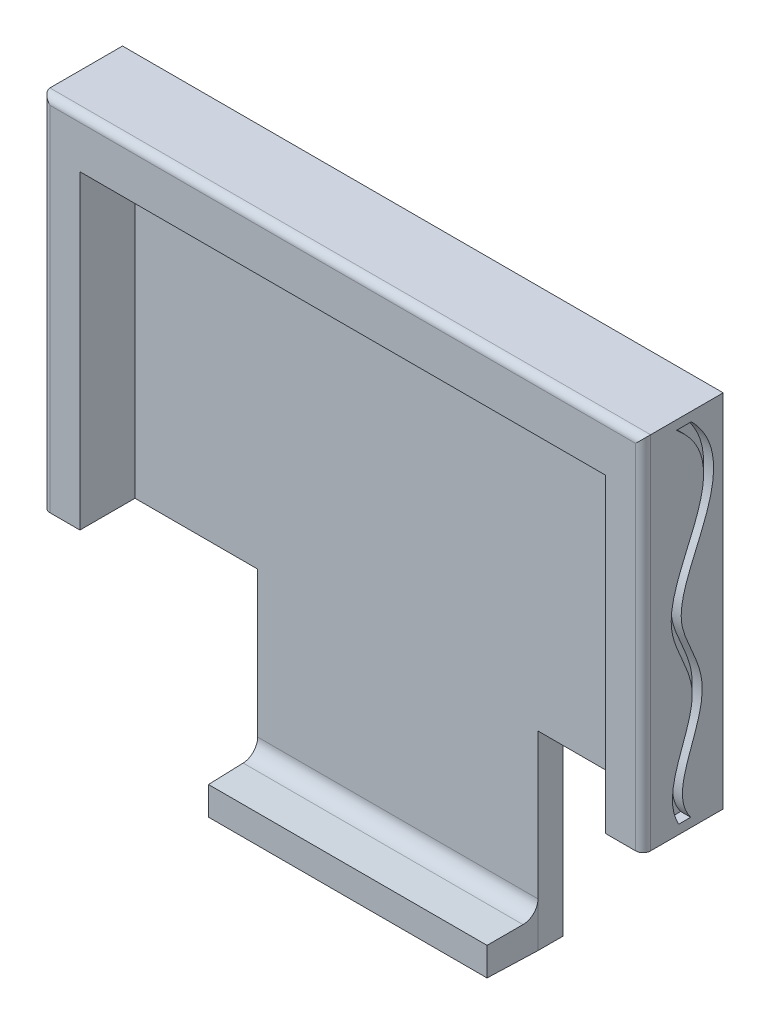
from build123d import *

# Parameters (mm, degrees)
ESBO_O1_W                  = 120
ESBO_O1_H                  = 110
RESSALTO_EXTRUS_O1_DEPTH   = 16
ESBO_O2_W                  = 105
ESBO_O2_H                  = 100
CORTE_EXTRUS_O1_DEPTH      = 11
CORTE_EXTRUS_O2_DEPTH      = 164.159431232
CORTE_EXTRUS_O2_DEPTH_BACK = 164.159431232
ESBO_O3_W                  = 32
ESBO_O3_H                  = 38
ESBO_O4_W                  = 56
ESBO_O4_H                  = 6
RESSALTO_EXTRUS_O2_DEPTH   = 10
RESSALTO_EXTRUS_O2_TAPER   = 1
CORTE_EXTRUS_O3_START      = -7.5
CORTE_EXTRUS_O3_DEPTH      = 105
CORTE_EXTRUS_O5_START      = -2
CORTE_EXTRUS_O5_DEPTH      = 166.572613845
ESBO_O9_W                  = 3.98970614
ESBO_O9_H                  = 1.819278396
RESSALTO_EXTRUS_O3_DEPTH   = 16
ESBO_O11_W                 = 5.503817982
ESBO_O11_H                 = 82
RESSALTO_EXTRUS_O4_DEPTH   = 16
RESSALTO_EXTRUS_O7_DEPTH   = 107
RESSALTO_EXTRUS_O8_REACH   = 165.573
ESBO_O16_W                 = 3.99
ESBO_O16_H                 = 1.82
ESBO_O17_W                 = 5.503817982
ESBO_O17_H                 = 10
CORTE_EXTRUS_O6_DEPTH      = 164.572613995
FILETE2_R                  = 1.5
CORTE_EXTRUS_O7_DEPTH      = 2
FILETE3_R                  = 3


with BuildPart() as part:
    # Esboço1 → Ressalto-extrusão1 (new body)
    with BuildSketch(Plane.XY):
        with Locations((60, 55)):
            Rectangle(ESBO_O1_W, ESBO_O1_H)
    extrude(amount=RESSALTO_EXTRUS_O1_DEPTH)

    # Esboço2 → Corte-extrusão1 (cut)
    with BuildSketch(Plane.XY.offset(16)):
        with Locations((60, 50)):
            Rectangle(ESBO_O2_W, ESBO_O2_H)
    extrude(amount=-CORTE_EXTRUS_O1_DEPTH, mode=Mode.SUBTRACT)

    # Esboço3 → Corte-extrusão2 (cut, two sides: drawn at the far end of the back side and taken through both)
    with BuildSketch(Plane.XY.offset(5).offset(-CORTE_EXTRUS_O2_DEPTH_BACK)):
        with Locations((16, 19)):
            Rectangle(ESBO_O3_W, ESBO_O3_H)
        with Locations((104, 19)):
            Rectangle(ESBO_O3_W, ESBO_O3_H)
    extrude(amount=CORTE_EXTRUS_O2_DEPTH + CORTE_EXTRUS_O2_DEPTH_BACK, mode=Mode.SUBTRACT)

    # Esboço4 → Ressalto-extrusão2 (add)
    with BuildSketch(Plane.XY.offset(5)):
        with Locations((60, 3)):
            Rectangle(ESBO_O4_W, ESBO_O4_H)
    extrude(amount=RESSALTO_EXTRUS_O2_DEPTH, taper=RESSALTO_EXTRUS_O2_TAPER)

    # Esboço6 → Corte-extrusão3 (cut)
    with BuildSketch(Plane.ZY.offset(CORTE_EXTRUS_O3_START)):
        Polygon((13.186092373, 100), (2.204933851, 107.160275857), (2.204933851, 101.956517901), (5.032172426, 96.343015224), align=None)
    extrude(amount=-CORTE_EXTRUS_O3_DEPTH, mode=Mode.SUBTRACT)

    # Esboço8 → Corte-extrusão5 (cut)
    with BuildSketch(Plane(origin=(120, 0, 0), x_dir=(0, 0, -1), z_dir=(1, 0, 0)).offset(CORTE_EXTRUS_O5_START)):
        with BuildLine():
            Line((-11.792318261, 110), (-10.690143183, 111.668894873))
            add(Edge.make_bspline(
                [(-6.082458572, 39.276495845), (-6.214162579, 39.435352315), (-6.474263337, 39.767158501), (-6.915598907, 40.402945876), (-7.360031734, 41.185353069), (-7.738204238, 42.100680466), (-8.069368292, 43.31178852), (-8.201478516, 44.846869769), (-7.984741062, 46.805669125), (-7.456321103, 48.885471276), (-6.465738379, 51.791803071), (-5.272267128, 54.856926621), (-4.41789659, 58.109560913), (-4.09927868, 60.665032964), (-4.356032099, 63.353506331), (-5.107827309, 65.798820309), (-6.060511408, 68.085684526), (-7.031478084, 70.239150077), (-7.843018941, 72.276734787), (-8.337743386, 74.135986953), (-8.438637878, 75.927638214), (-8.142119764, 78.508684731), (-7.037426342, 81.996601684), (-5.057308292, 86.490856249), (-3.068625359, 91.213924398), (-1.976015748, 95.384766301), (-1.867130555, 98.890807063), (-2.294947679, 101.57514134), (-3.333053367, 104.2468859), (-4.750190463, 106.40275737), (-6.230261913, 108.071676743), (-7.517771082, 109.295924067), (-8.746974053, 110.296643718), (-9.821340585, 111.082325969), (-10.401129021, 111.478023529), (-10.690143183, 111.668894873)],
                knots=[0, 0, 0, 0, 0.0078125, 0.015625, 0.03125, 0.046875, 0.0625, 0.09375, 0.125, 0.15625, 0.1875, 0.25, 0.28125, 0.3125, 0.34375, 0.375, 0.40625, 0.4375, 0.46875, 0.5, 0.53125, 0.5625, 0.625, 0.6875, 0.75, 0.8125, 0.84375, 0.875, 0.90625, 0.9375, 0.953125, 0.96875, 0.984375, 0.9921875, 1, 1, 1, 1], degree=3))
            Line((-6.082458572, 39.276495845), (-4.14961014, 38))
            Line((-4.14961014, 38), (-7.622120339, 38))
            add(Edge.make_bspline(
                [(-7.622120339, 38), (-14.29051588, 46.043170452), (-0.893468518, 58.395190772), (-18.324006057, 81.192013192), (5.928787095, 98.29659016), (-11.792318261, 110)],
                knots=[0, 0, 0, 0, 0.328017048, 0.501208499, 1, 1, 1, 1], degree=3))
        make_face()
    corte_extrus_o5 = extrude(amount=CORTE_EXTRUS_O5_DEPTH, mode=Mode.SUBTRACT)

    # Esboço9 → Ressalto-extrusão3 (add)
    with BuildSketch(Plane.XY.offset(16)):
        with Locations((1.99485307, 109.090360802)):
            Rectangle(ESBO_O9_W, ESBO_O9_H)
        with Locations((118.00514693, 109.090360802)):
            Rectangle(ESBO_O9_W, ESBO_O9_H)
        with Locations((1.99485307, 38.909639198)):
            Rectangle(ESBO_O9_W, ESBO_O9_H)
        with Locations((118.00514693, 38.909639198)):
            Rectangle(ESBO_O9_W, ESBO_O9_H)
    extrude(amount=-RESSALTO_EXTRUS_O3_DEPTH)

    # Esboço11 → Ressalto-extrusão4 (add)
    with BuildSketch(Plane.XY.offset(16)):
        with Locations((4.748091009, 69)):
            Rectangle(ESBO_O11_W, ESBO_O11_H)
        with Locations((115.251908991, 69)):
            Rectangle(ESBO_O11_W, ESBO_O11_H)
    extrude(amount=-RESSALTO_EXTRUS_O4_DEPTH)

    # Esboço15 → Ressalto-extrusão7 (add)
    with BuildSketch(Plane.ZY.offset(-112.5)):
        Polygon((5.982938485, 104.696823999), (8.582940457, 103.001490004), (11.792318261, 110), (8.41615138, 110), (2.795224019, 106.775376538), align=None)
    extrude(amount=RESSALTO_EXTRUS_O7_DEPTH)

    # Espelhar1: Corte-extrusão5 across plane
    add(corte_extrus_o5.mirror(Plane(origin=(60, 0, 0), x_dir=(0, 0, 1), z_dir=(1, 0, 0))), mode=Mode.SUBTRACT)

    # Esboço16 → Ressalto-extrusão8 (add, up to next)
    with BuildSketch(Plane.XY.offset(16), mode=Mode.PRIVATE) as ressalto_extrus_o8_sk1:
        with Locations((1.995, 109.09)):
            Rectangle(ESBO_O16_W, ESBO_O16_H)
    ressalto_extrus_o8_tool1 = extrude(ressalto_extrus_o8_sk1.sketch, amount=-RESSALTO_EXTRUS_O8_REACH, mode=Mode.PRIVATE) - part.part
    # Esboço16 → Ressalto-extrusão8 (add, up to next)
    with BuildSketch(Plane.XY.offset(16), mode=Mode.PRIVATE) as ressalto_extrus_o8_sk2:
        with Locations((1.995, 38.91)):
            Rectangle(ESBO_O16_W, ESBO_O16_H)
    ressalto_extrus_o8_tool2 = extrude(ressalto_extrus_o8_sk2.sketch, amount=-RESSALTO_EXTRUS_O8_REACH, mode=Mode.PRIVATE) - part.part
    add(ressalto_extrus_o8_tool1.solids().sort_by_distance((1.995, 109.09, 16))[0])
    add(ressalto_extrus_o8_tool2.solids().sort_by_distance((1.995, 38.91, 16))[0])

    # Esboço17 → Corte-extrusão6 (cut, through all)
    with BuildSketch(Plane.XY.offset(16)):
        with Locations((4.748091009, 33)):
            Rectangle(ESBO_O17_W, ESBO_O17_H)
        with Locations((115.251908991, 33)):
            Rectangle(ESBO_O17_W, ESBO_O17_H)
    extrude(amount=-CORTE_EXTRUS_O6_DEPTH, mode=Mode.SUBTRACT)

    # Filete2
    filete2_edges = [part.edges().sort_by_distance(p)[0] for p in [
        (120, 74, 16),
        (0, 74, 16),
        (60, 110, 16),
    ]]
    fillet(filete2_edges, radius=FILETE2_R)

    # Esboço19 → Corte-extrusão7 (cut)
    # profile 1 of 3: a face of its own
    with BuildSketch(Plane(origin=(0, -0.087248742, 0.001522932), x_dir=(1, 0, 0), z_dir=(0, -0.9998476951563913, 0.01745240643728355))):
        with BuildLine():
            Line((53.065882353, 12.953056458), (54.913676471, 12.953056458))
            add(Edge.make_bspline(
                [(54.913676471, 12.953056458), (54.974591286, 12.953067594), (55.092599007, 12.953089168), (55.263753348, 12.945929084), (55.424175032, 12.936851267), (55.573686682, 12.926435298), (55.712688537, 12.909217603), (55.840504389, 12.888657105), (55.957991642, 12.866266887), (56.095980935, 12.830347104), (56.251561295, 12.780405537), (56.415982671, 12.70231006), (56.558157144, 12.61475191), (56.672360034, 12.508831327), (56.768515685, 12.394026894), (56.845526068, 12.266957393), (56.907044389, 12.128761551), (56.943027584, 12.003824229), (56.96437895, 11.894729203), (56.98068202, 11.801818125), (56.990868718, 11.697671922), (57.00188917, 11.583230617), (57.008712096, 11.45829674), (57.016108116, 11.323235828), (57.017642782, 11.177321529), (57.018420041, 11.076522682), (57.018823529, 11.024196164)],
                knots=[0, 0, 0, 0, 1.282116328, 2.483790255, 3.605139524, 4.664625684, 5.637807542, 6.552167763, 7.389704287, 8.15395599, 9.55297752, 10.821157388, 11.978284333, 13.052062185, 14.084386006, 15.121869212, 16.168777701, 17.260175691, 17.849816911, 18.508854864, 19.244685311, 20.051485104, 20.928949087, 21.878043587, 22.898453747, 24, 24, 24, 24], degree=3))
            Line((57.018823529, 11.024196164), (57.018823529, 10.423277046))
            add(Edge.make_bspline(
                [(57.018823529, 10.423277046), (57.018284452, 10.370082505), (57.017245016, 10.267514131), (57.010588447, 10.119055461), (57.0010932, 9.9820283), (56.985502729, 9.85577555), (56.965379184, 9.741060002), (56.940685768, 9.637152233), (56.913287768, 9.544186345), (56.868559488, 9.435997635), (56.796598155, 9.313459612), (56.679056191, 9.186618401), (56.531589709, 9.079326605), (56.355930755, 8.989071834), (56.150873392, 8.919125227), (55.917600201, 8.870020998), (55.656017468, 8.840885076), (55.472211874, 8.837295607), (55.375625, 8.835409399)],
                knots=[0, 0, 0, 0, 0.947856084, 1.827632211, 2.64771649, 3.394739747, 4.093395838, 4.72184435, 5.297256668, 5.818159949, 6.805173689, 7.811325505, 8.876778169, 10.039043022, 11.3177114, 12.725373953, 14.279236855, 16, 16, 16, 16], degree=3))
            Line((55.375625, 8.835409399), (54.877647059, 8.835409399))
            Line((54.877647059, 8.835409399), (54.877647059, 5.953056458))
            Line((54.877647059, 5.953056458), (53.065882353, 5.953056458))
            Line((53.065882353, 5.953056458), (53.065882353, 12.953056458))
        make_face()
        with BuildLine():
            Line((54.877647059, 11.800115281), (54.877647059, 9.992210869))
            add(Edge.make_bspline(
                [(54.877647059, 9.992210869), (54.901663947, 9.991256832), (54.946258087, 9.989485392), (54.990880357, 9.988708883), (55.011470588, 9.988350575)],
                knots=[0, 0, 0, 0, 1.077132021, 2, 2, 2, 2], degree=3))
            add(Edge.make_bspline(
                [(55.011470588, 9.988350575), (55.050193203, 9.989569896), (55.121610204, 9.991818717), (55.22030296, 10.01440968), (55.299579797, 10.054524976), (55.364249121, 10.112826434), (55.406901612, 10.200286106), (55.433959393, 10.315853363), (55.451104691, 10.463538932), (55.453049178, 10.572917583), (55.454117647, 10.633019693)],
                knots=[0, 0, 0, 0, 1.01407232, 1.870276719, 2.629541919, 3.321573256, 4.111194849, 5.133769377, 6.425044487, 8, 8, 8, 8], degree=3))
            Line((55.454117647, 10.633019693), (55.454117647, 11.217210869))
            add(Edge.make_bspline(
                [(55.454117647, 11.217210869), (55.453408867, 11.272633917), (55.4521161, 11.373721896), (55.43095429, 11.509405814), (55.398297117, 11.615053159), (55.346841477, 11.695180697), (55.266096091, 11.745307085), (55.162211295, 11.778183672), (55.029317321, 11.797625661), (54.9313296, 11.799234099), (54.877647059, 11.800115281)],
                knots=[0, 0, 0, 0, 1.351937155, 2.465844075, 3.340137483, 4.040214777, 4.73439277, 5.608686178, 6.68991949, 8, 8, 8, 8], degree=3))
        make_face(mode=Mode.SUBTRACT)
    # profile 2 of 3: a face of its own
    with BuildSketch(Plane(origin=(0, -0.087248742, 0.001522932), x_dir=(1, 0, 0), z_dir=(0, -0.9998476951563913, 0.01745240643728355))):
        Polygon((62.223529412, 12.953056458), (62.223529412, 5.953056458), (60.411764706, 5.953056458), (60.411764706, 8.91776234), (59.752941176, 8.91776234), (59.752941176, 5.953056458), (57.941176471, 5.953056458), (57.941176471, 12.953056458), (59.752941176, 12.953056458), (59.752941176, 10.482468222), (60.411764706, 10.482468222), (60.411764706, 12.953056458), align=None)
    # profile 3 of 3: a face of its own
    with BuildSketch(Plane(origin=(0, -0.087248742, 0.001522932), x_dir=(1, 0, 0), z_dir=(0, -0.9998476951563913, 0.01745240643728355))):
        with BuildLine():
            Line((67.14, 12.953056458), (66.398823529, 9.857100575))
            Line((66.398823529, 9.857100575), (67.469411765, 5.953056458))
            Line((67.469411765, 5.953056458), (65.74, 5.953056458))
            add(Edge.make_bspline(
                [(65.74, 5.953056458), (65.719882838, 6.045283853), (65.678518315, 6.234920059), (65.614062641, 6.526466708), (65.546861335, 6.833083235), (65.478355677, 7.154747198), (65.402848203, 7.490212408), (65.325673633, 7.840648835), (65.246193282, 8.206249538), (65.191463926, 8.454967926), (65.163529412, 8.581916752)],
                knots=[0, 0, 0, 0, 0.841778282, 1.730848397, 2.662654589, 3.640937664, 4.663594695, 5.728984732, 6.84084677, 8, 8, 8, 8], degree=3))
            add(Edge.make_bspline(
                [(65.163529412, 8.581916752), (65.132568942, 8.335296581), (65.070329897, 7.839522336), (65.009037916, 7.343630115), (64.978235294, 7.094416752)],
                knots=[0, 0, 0, 0, 0.994888998, 2, 2, 2, 2], degree=3))
            Line((64.978235294, 7.094416752), (64.834117647, 5.953056458))
            Line((64.834117647, 5.953056458), (63.022352941, 5.953056458))
            Line((63.022352941, 5.953056458), (63.763529412, 9.857100575))
            Line((63.763529412, 9.857100575), (63.022352941, 12.953056458))
            Line((63.022352941, 12.953056458), (64.751764706, 12.953056458))
            add(Edge.make_bspline(
                [(64.751764706, 12.953056458), (64.756815197, 12.929444196), (64.767850527, 12.877851371), (64.788110213, 12.794185974), (64.807815769, 12.696530119), (64.83123115, 12.585924619), (64.856883012, 12.462376666), (64.885194457, 12.325980518), (64.91623043, 12.176318312), (64.937516937, 12.072057552), (64.948639706, 12.017578517)],
                knots=[0, 0, 0, 0, 0.606171904, 1.324486497, 2.160792762, 3.106906467, 4.162828644, 5.32856003, 6.604101174, 8, 8, 8, 8], degree=3))
            add(Edge.make_bspline(
                [(64.948639706, 12.017578517), (64.984283455, 11.843445181), (65.056178093, 11.492212399), (65.127544745, 11.140871954), (65.163529412, 10.963718222)],
                knots=[0, 0, 0, 0, 0.991555144, 2, 2, 2, 2], degree=3))
            Line((65.163529412, 10.963718222), (65.575294118, 12.953056458))
            Line((65.575294118, 12.953056458), (67.14, 12.953056458))
        make_face()
    extrude(amount=-CORTE_EXTRUS_O7_DEPTH, mode=Mode.SUBTRACT)

    # Filete3
    filete3_edges = [part.edges().sort_by_distance(p)[0] for p in [
        (60, 6, 5),
    ]]
    fillet(filete3_edges, radius=FILETE3_R)


solid = part.part
